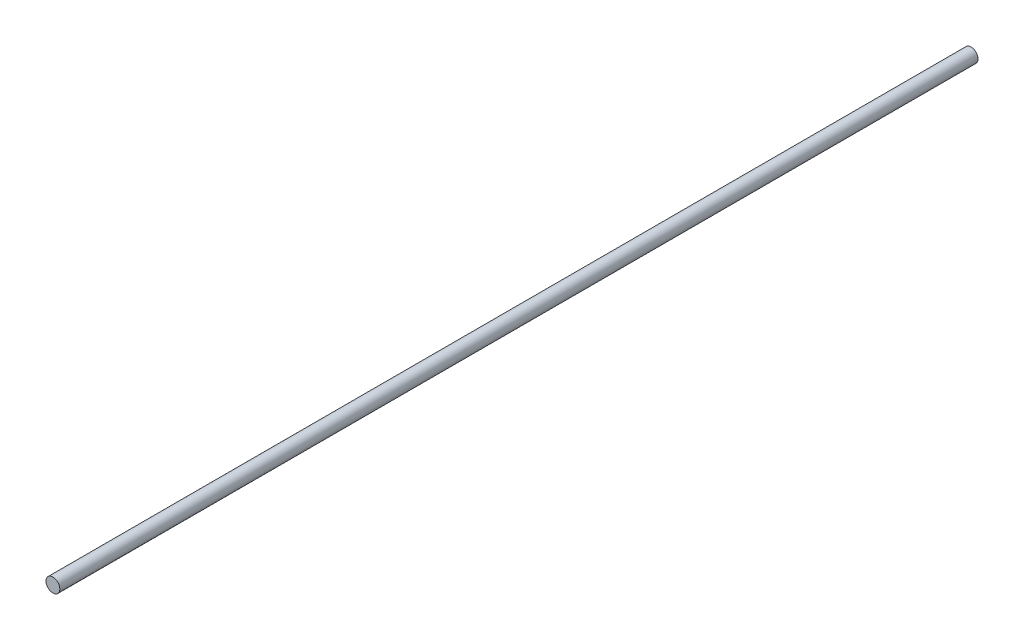
from build123d import *

# Parameters (mm, degrees)
SKETCH1_R           = 4.7625
BOSS_EXTRUDE1_DEPTH = 631.202414599


with BuildPart() as part:
    # Sketch1 → Boss-Extrude1 (new body)
    with BuildSketch(Plane.XY):
        Circle(SKETCH1_R)
    extrude(amount=BOSS_EXTRUDE1_DEPTH)


solid = part.part
